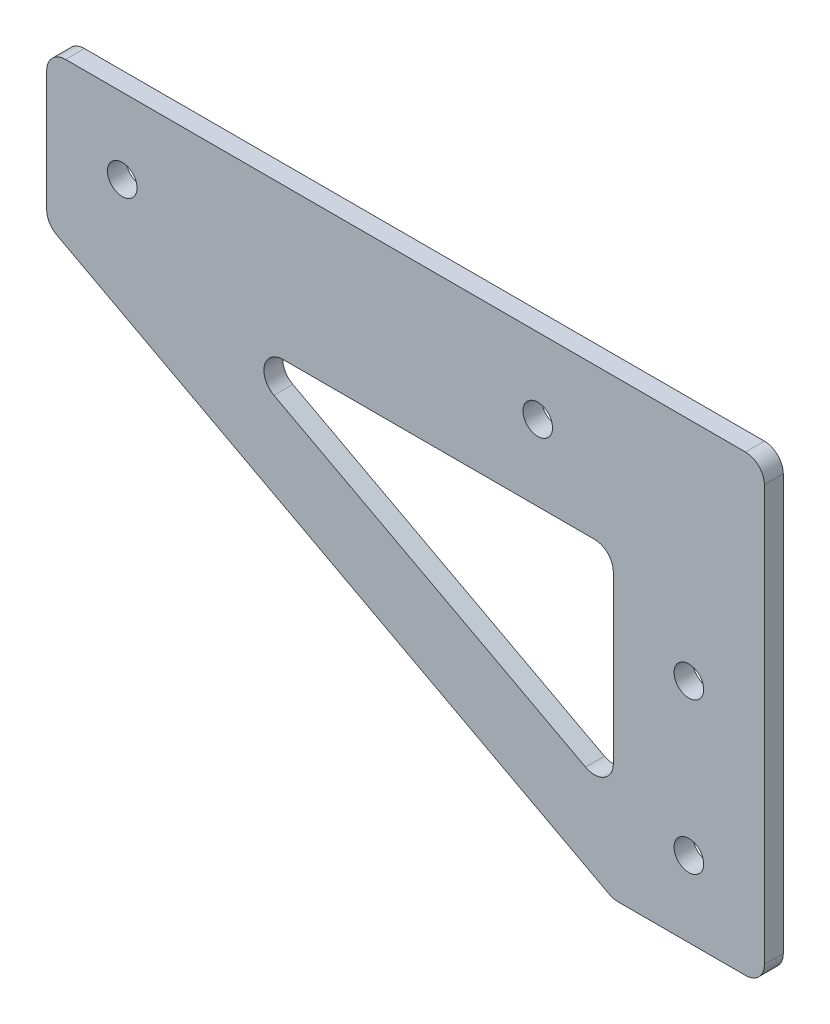
from build123d import *

# Parameters (mm, degrees)
BOSS_EXTRUDE1_DEPTH = 3.175
SKETCH2_R           = 2.4892
CUT_EXTRUDE1_DEPTH  = 152.971856141
FILLET1_R           = 3.175


with BuildPart() as part:
    # Sketch1 → Boss-Extrude1 (new body)
    with BuildSketch(Plane.XY):
        Polygon((7.627179371, 56.026836403), (102.877179371, 5.226836403), (128.277179371, 5.226836403), (128.277179371, 81.426836403), (7.627179371, 81.426836403), align=None)
        Polygon((34.614679371, 56.026836403), (102.877179371, 56.026836403), (102.877179371, 19.620169736), align=None, mode=Mode.SUBTRACT)
    extrude(amount=BOSS_EXTRUDE1_DEPTH)

    # Sketch2 → Cut-Extrude1 (cut, through all)
    with BuildSketch(Plane.XY.offset(3.175)):
        with Locations((115.577179371, 43.326836403)):
            Circle(SKETCH2_R)
        with Locations((115.577179371, 17.926836403)):
            Circle(SKETCH2_R)
        with Locations((90.177179371, 68.726836403)):
            Circle(SKETCH2_R)
        with Locations((20.327179371, 68.726836403)):
            Circle(SKETCH2_R)
    extrude(amount=-CUT_EXTRUDE1_DEPTH, mode=Mode.SUBTRACT)

    # Fillet1
    fillet1_edges = [part.edges().sort_by_distance(p)[0] for p in [
        (34.614679371, 56.026836403, 1.5875),
        (102.877179371, 19.620169736, 1.5875),
        (102.877179371, 56.026836403, 1.5875),
        (128.277179371, 5.226836403, 1.5875),
        (102.877179371, 5.226836403, 1.5875),
        (7.627179371, 56.026836403, 1.5875),
        (7.627179371, 81.426836403, 1.5875),
        (128.277179371, 81.426836403, 1.5875),
    ]]
    fillet(fillet1_edges, radius=FILLET1_R)


solid = part.part
